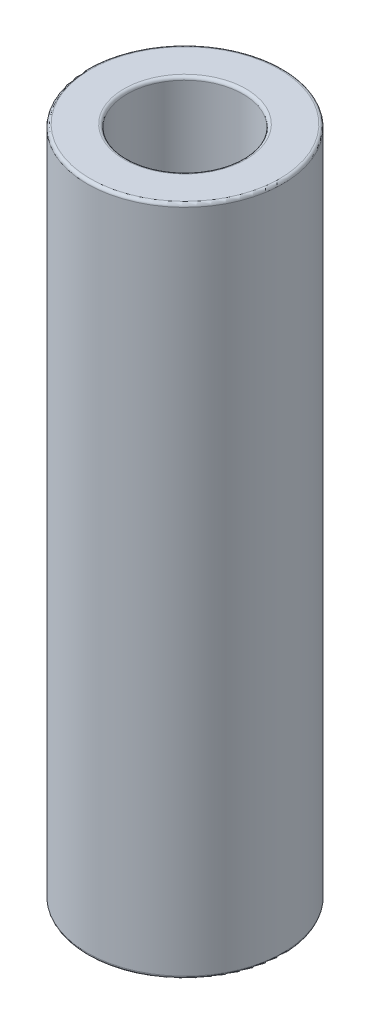
from build123d import *

# Parameters (mm, degrees)
SKETCH1_R           = 16
SKETCH1_R_2         = 9.5
BOSS_EXTRUDE1_DEPTH = 110
FILLET1_R           = 0.5


with BuildPart() as part:
    # Sketch1 → Boss-Extrude1 (new body)
    with BuildSketch(Plane(origin=(0, 0, 0), x_dir=(1, 0, 0), z_dir=(0, 1, 0))):
        with Locations(Location((0, 0, 0), (0, 0, 270))):
            Circle(SKETCH1_R)
        with Locations(Location((0, 0, 0), (0, 0, 270))):
            Circle(SKETCH1_R_2, mode=Mode.SUBTRACT)
    extrude(amount=BOSS_EXTRUDE1_DEPTH)

    # Fillet1
    fillet1_edges = [part.edges().sort_by_distance(p)[0] for p in [
        (0, 110, -16),
        (0, 0, -16),
        (0, 0, -9.5),
        (0, 110, -9.5),
    ]]
    fillet(fillet1_edges, radius=FILLET1_R)


solid = part.part
